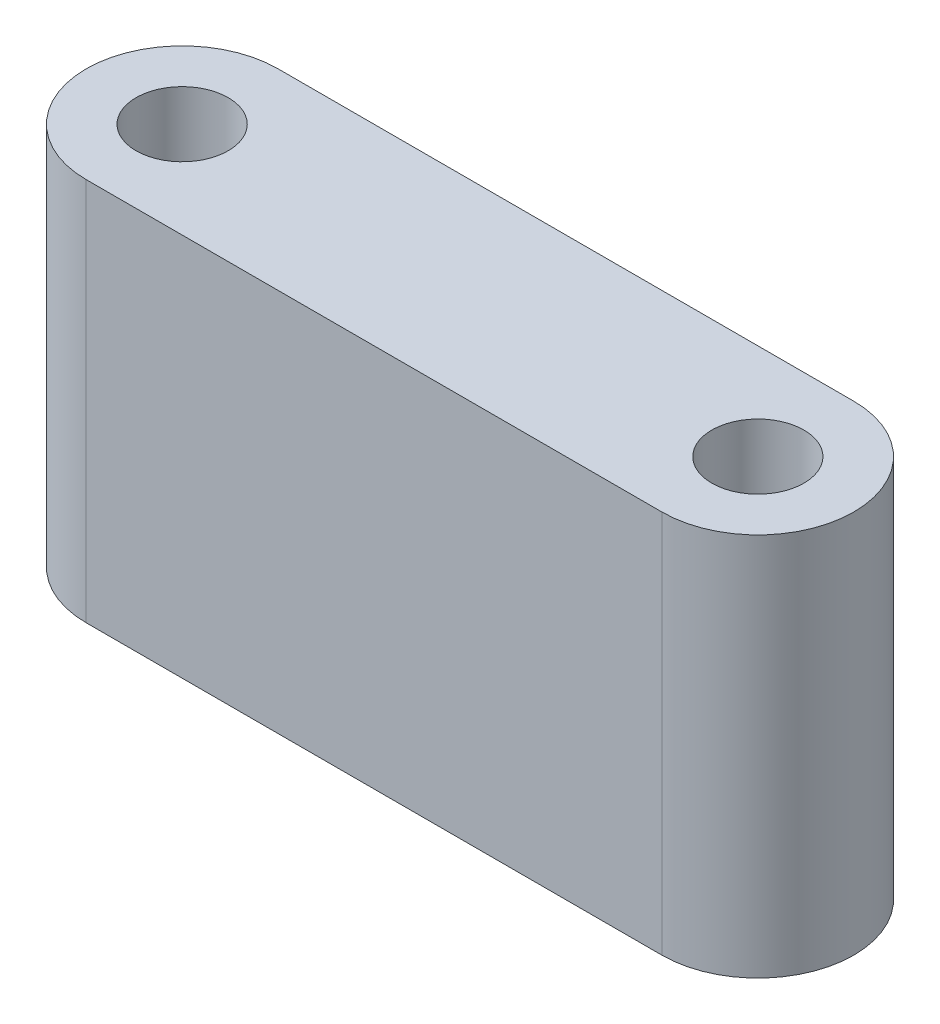
from build123d import *

# Parameters (mm, degrees)
SKETCH_1_R      = 2.4
EXTRUDE_1_DEPTH = 20


with BuildPart() as part:
    # 草图1 → 凸台-拉伸1 (new body)
    with BuildSketch(Plane(origin=(0, 0, 0), x_dir=(1, 0, 0), z_dir=(0, 1, 0))):
        with BuildLine():
            Line((0, 5), (30, 5))
            ThreePointArc((30, 5), (35, 0), (30, -5))
            Line((30, -5), (0, -5))
            ThreePointArc((0, -5), (-5, 0), (0, 5))
        make_face()
        with Locations(Location((0, 0, 0), (0, 0, 270))):
            Circle(SKETCH_1_R, mode=Mode.SUBTRACT)
        with Locations(Location((30, 0, 0), (0, 0, 270))):
            Circle(SKETCH_1_R, mode=Mode.SUBTRACT)
    extrude(amount=EXTRUDE_1_DEPTH)


solid = part.part
